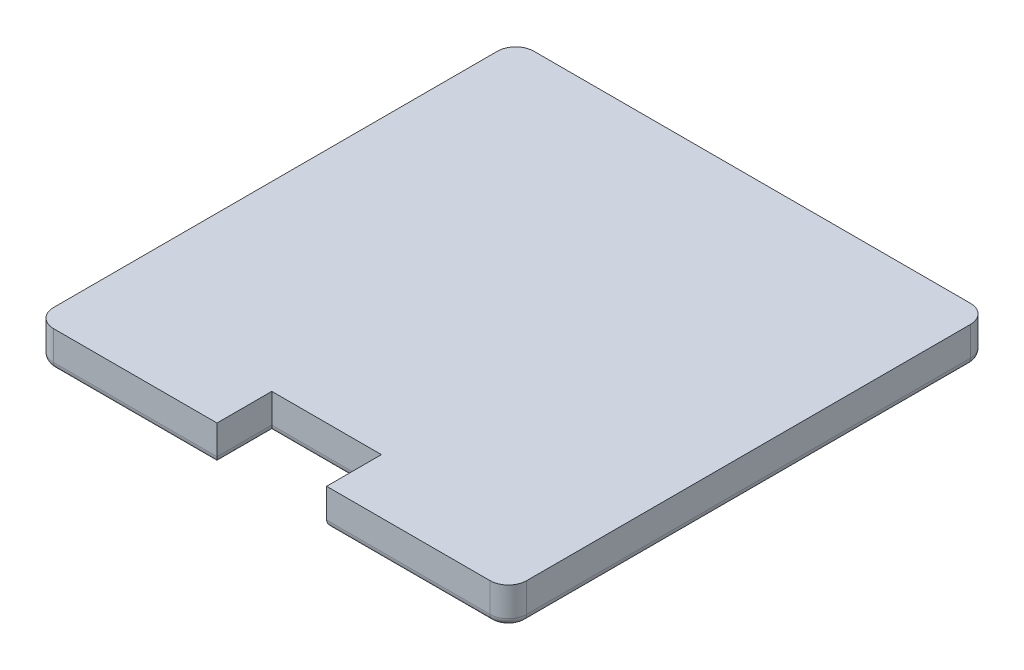
from build123d import *

# Parameters (mm, degrees)
BOSS_EXTRUDE1_DEPTH = 2.54
FILLET1_R           = 0.508


with BuildPart() as part:
    # Sketch1 → Boss-Extrude1 (new body)
    with BuildSketch(Plane(origin=(0, 0, 0), x_dir=(1, 0, 0), z_dir=(0, 1, 0))):
        with BuildLine():
            Line((-3.81, -16.7005), (-3.81, -12.8905))
            Line((-3.81, -12.8905), (3.81, -12.8905))
            Line((3.81, -12.8905), (3.81, -16.7005))
            Line((3.81, -16.7005), (15.1765, -16.7005))
            ThreePointArc((15.1765, -16.7005), (16.074525612, -16.328525612), (16.4465, -15.4305))
            Line((16.4465, -15.4305), (16.4465, 15.4305))
            ThreePointArc((16.4465, 15.4305), (16.074525612, 16.328525612), (15.1765, 16.7005))
            Line((15.1765, 16.7005), (-15.1765, 16.7005))
            ThreePointArc((-15.1765, 16.7005), (-16.074525612, 16.328525612), (-16.4465, 15.4305))
            Line((-16.4465, 15.4305), (-16.4465, -15.4305))
            ThreePointArc((-16.4465, -15.4305), (-16.074525612, -16.328525612), (-15.1765, -16.7005))
            Line((-15.1765, -16.7005), (-3.81, -16.7005))
        make_face()
    extrude(amount=BOSS_EXTRUDE1_DEPTH)

    # Fillet1
    fillet1_edges = [part.edges().sort_by_distance(p)[0] for p in [
        (-16.4465, 0, 0),
        (-16.074525612, 0, -16.328525612),
        (0, 0, -16.7005),
        (16.074525612, 0, -16.328525612),
        (16.4465, 0, 0),
        (16.074525612, 0, 16.328525612),
        (9.49325, 0, 16.7005),
        (3.81, 0, 14.7955),
        (0, 0, 12.8905),
        (-3.81, 0, 14.7955),
        (-9.49325, 0, 16.7005),
        (-16.074525612, 0, 16.328525612),
    ]]
    fillet(fillet1_edges, radius=FILLET1_R)


solid = part.part
